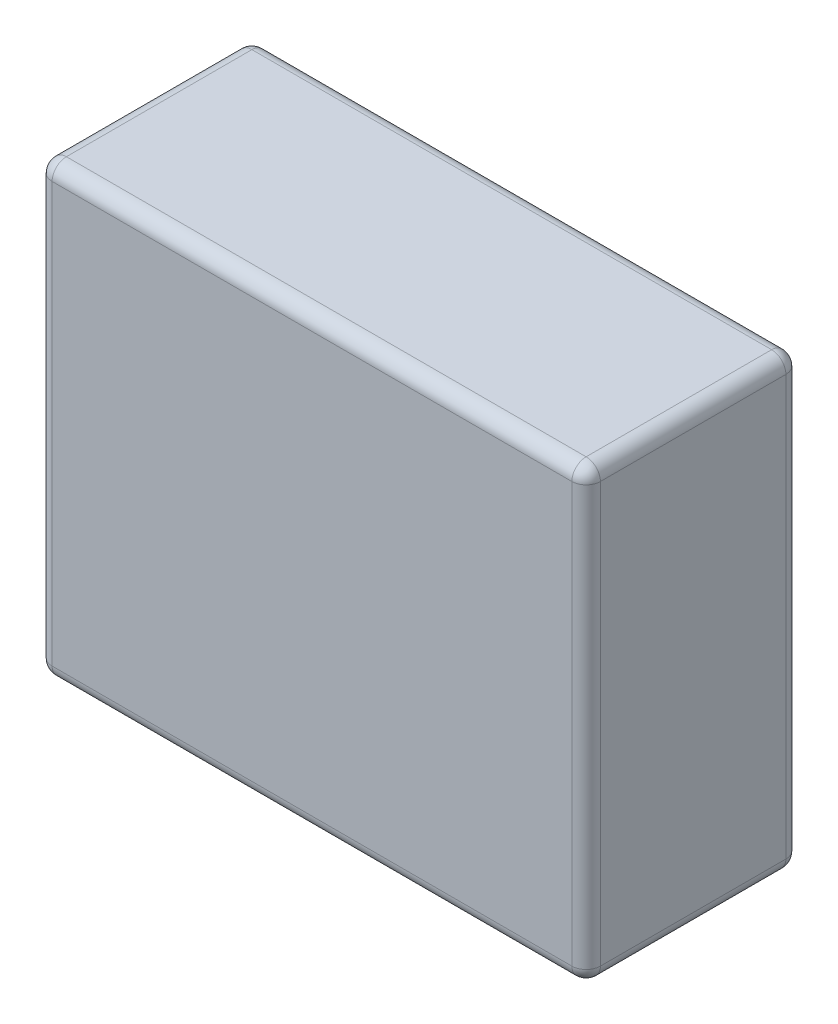
from build123d import *

# Parameters (mm, degrees)
CROQUIS3_W              = 76.851762212
CROQUIS3_H              = 62.828734274
SALIENTE_EXTRUIR1_DEPTH = 30
CROQUIS4_W              = 69
CROQUIS4_H              = 55
CORTAR_EXTRUIR1_DEPTH   = 26
REDONDEO5_R             = 2
REDONDEO6_R             = 2
REDONDEO7_R             = 2
CROQUIS5_W              = 3
CROQUIS5_H              = 55
CORTAR_EXTRUIR2_DEPTH   = 70
CROQUIS6_W              = 1.6
CROQUIS6_H              = 57.8
CORTAR_EXTRUIR3_DEPTH   = 73


with BuildPart() as part:
    # Croquis3 → Saliente-Extruir1 (new body)
    with BuildSketch(Plane.XY):
        with Locations((38.425881106, 31.414367137)):
            Rectangle(CROQUIS3_W, CROQUIS3_H)
    extrude(amount=SALIENTE_EXTRUIR1_DEPTH)

    # Croquis4 → Cortar-Extruir1 (cut)
    with BuildSketch(Plane.XY):
        with Locations((38.5, 31.5)):
            Rectangle(CROQUIS4_W, CROQUIS4_H)
    extrude(amount=CORTAR_EXTRUIR1_DEPTH, mode=Mode.SUBTRACT)

    # Redondeo5
    redondeo5_edges = [part.edges().sort_by_distance(p)[0] for p in [
        (0, 0, 15),
        (0, 62.828734274, 15),
        (76.851762212, 62.828734274, 15),
        (76.851762212, 0, 15),
    ]]
    fillet(redondeo5_edges, radius=REDONDEO5_R)

    # Redondeo6
    redondeo6_edges = [part.edges().sort_by_distance(p)[0] for p in [
        (0, 31.414367137, 0),
        (38.425881106, 0, 0),
        (38.425881106, 62.828734274, 0),
        (76.851762212, 31.414367137, 0),
        (76.265975775, 62.242947836, 0),
        (76.265975775, 0.585786438, 0),
        (0.585786438, 0.585786438, 0),
        (0.585786438, 62.242947836, 0),
    ]]
    fillet(redondeo6_edges, radius=REDONDEO6_R)

    # Redondeo7
    redondeo7_edges = [part.edges().sort_by_distance(p)[0] for p in [
        (0, 31.414367137, 30),
        (38.425881106, 62.828734274, 30),
        (38.425881106, 0, 30),
        (76.851762212, 31.414367137, 30),
        (76.265975775, 62.242947836, 30),
        (76.265975775, 0.585786438, 30),
        (0.585786438, 0.585786438, 30),
        (0.585786438, 62.242947836, 30),
    ]]
    fillet(redondeo7_edges, radius=REDONDEO7_R)

    # Croquis5 → Cortar-Extruir2 (cut)
    with BuildSketch(Plane(origin=(0, 0, 0), x_dir=(0, 0, -1), z_dir=(1, 0, 0))):
        with Locations((-1.5, 31.5)):
            Rectangle(CROQUIS5_W, CROQUIS5_H)
    extrude(amount=CORTAR_EXTRUIR2_DEPTH, mode=Mode.SUBTRACT)

    # Croquis6 → Cortar-Extruir3 (cut)
    with BuildSketch(Plane(origin=(0, 0, 0), x_dir=(0, 0, -1), z_dir=(1, 0, 0))):
        with Locations((-2.2, 31.5)):
            Rectangle(CROQUIS6_W, CROQUIS6_H)
    extrude(amount=CORTAR_EXTRUIR3_DEPTH, mode=Mode.SUBTRACT)


solid = part.part
